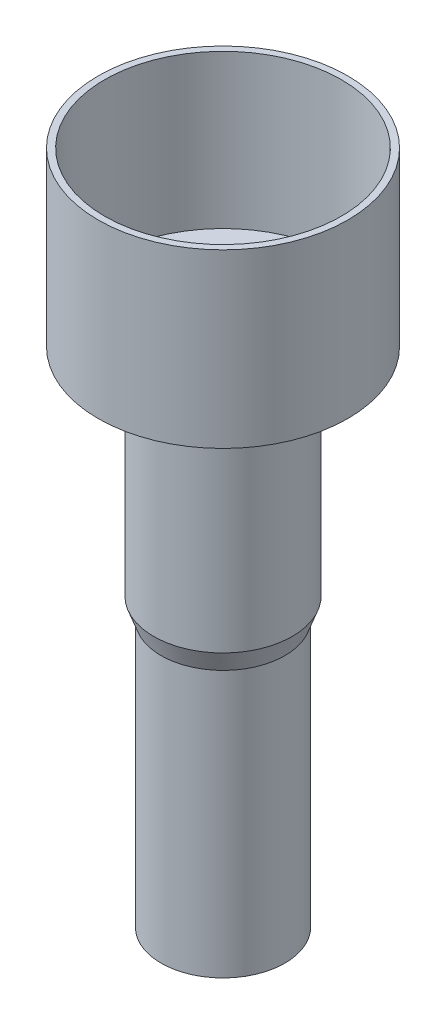
from build123d import *


with BuildPart() as part:
    # Sketch1 → Revolve1 (revolve)
    with BuildSketch(Plane.XY, mode=Mode.PRIVATE) as revolve1_sk:
        Polygon((-3.35, 14.401009032), (-3.35, 0), (-2.15, 0), (-2.15, 23), (-1.5, 23), (-1.5, 24), (-2.1, 24), (-2.1, 28.2), (-6.4, 28.2), (-6.4, 36.5), (-6.75, 36.5), (-6.75, 27.2), (-3.75, 27.2), (-3.75, 15.5), align=None)
    revolve(revolve1_sk.sketch.rotate(Axis((0, 0, 0), (0, 1, 0)), 270), axis=Axis((0, 0, 0), (0, 1, 0)))


solid = part.part
